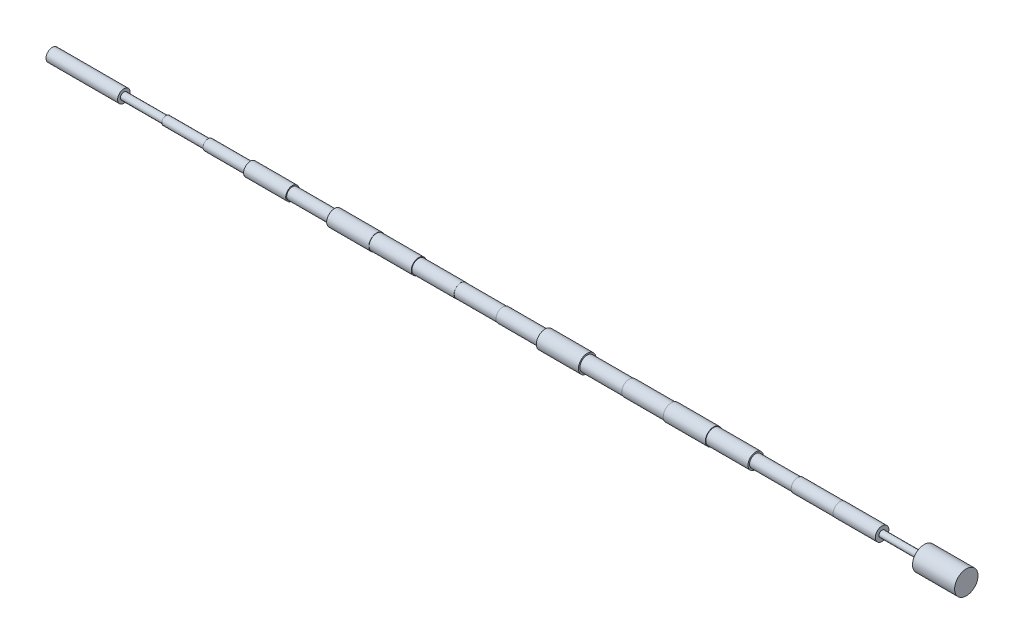
from build123d import *

# Parameters (mm, degrees)
SKETCH1_W           = 10
SKETCH1_H           = 0.831
SKETCH1_H_2         = 1.354
SKETCH1_H_3         = 1.581
SKETCH1_H_4         = 1.737
SKETCH1_H_5         = 1.458
SKETCH1_H_6         = 0.738
SKETCH2_R           = 1.5
BOSS_EXTRUDE1_DEPTH = 17


with BuildPart() as part:
    # Sketch1 → Revolve1 (revolve)
    with BuildSketch(Plane.XY, mode=Mode.PRIVATE) as revolve1_sk:
        with Locations((5, 0.4155)):
            Rectangle(SKETCH1_W, SKETCH1_H)
        Polygon((10, 0.831), (10, 0), (20, 0), (20, 1.008), (10, 1.008), align=None)
        Polygon((20, 1.008), (20, 0), (30, 0), (30, 1.222), (20, 1.222), align=None)
        Polygon((30, 1.222), (30, 0), (40, 0), (40, 1.354), (40, 1.59), (30, 1.59), align=None)
        with Locations((45, 0.677)):
            Rectangle(SKETCH1_W, SKETCH1_H_2)
        Polygon((50, 1.354), (50, 0), (60, 0), (60, 1.783), (60, 1.867), (50, 1.867), align=None)
        Polygon((60, 1.783), (60, 0), (70, 0), (70, 1.623), (70, 1.783), align=None)
        Polygon((70, 1.623), (70, 0), (80, 0), (80, 1.581), (80, 1.623), align=None)
        with Locations((85, 0.7905)):
            Rectangle(SKETCH1_W, SKETCH1_H_3)
        Polygon((90, 1.581), (90, 0), (100, 0), (100, 1.655), (90, 1.655), align=None)
        Polygon((100, 1.655), (100, 0), (110, 0), (110, 1.737), (110, 2.092), (100, 2.092), align=None)
        with Locations((115, 0.8685)):
            Rectangle(SKETCH1_W, SKETCH1_H_4)
        Polygon((120, 1.737), (120, 0), (130, 0), (130, 1.808), (120, 1.808), align=None)
        Polygon((130, 1.808), (130, 0), (140, 0), (140, 1.826), (140, 1.957), (130, 1.957), align=None)
        Polygon((140, 1.826), (140, 0), (150, 0), (150, 1.458), (150, 1.826), align=None)
        with Locations((155, 0.729)):
            Rectangle(SKETCH1_W, SKETCH1_H_5)
        Polygon((160, 1.458), (160, 0), (170, 0), (170, 1.573), (160, 1.573), align=None)
        Polygon((170, 1.573), (170, 0), (180, 0), (180, 0.738), (180, 1.608), (170, 1.608), align=None)
        with Locations((185, 0.369)):
            Rectangle(SKETCH1_W, SKETCH1_H_6)
        Polygon((190, 0.738), (190, 0), (200, 0), (200, 2.782), (190, 2.782), align=None)
    revolve(revolve1_sk.sketch.rotate(Axis((0, 0, 0), (1, 0, 0)), 90), axis=Axis((0, 0, 0), (1, 0, 0)))

    # Sketch2 → Boss-Extrude1 (add)
    with BuildSketch(Plane.ZY):
        Circle(SKETCH2_R)
    extrude(amount=BOSS_EXTRUDE1_DEPTH)


solid = part.part
